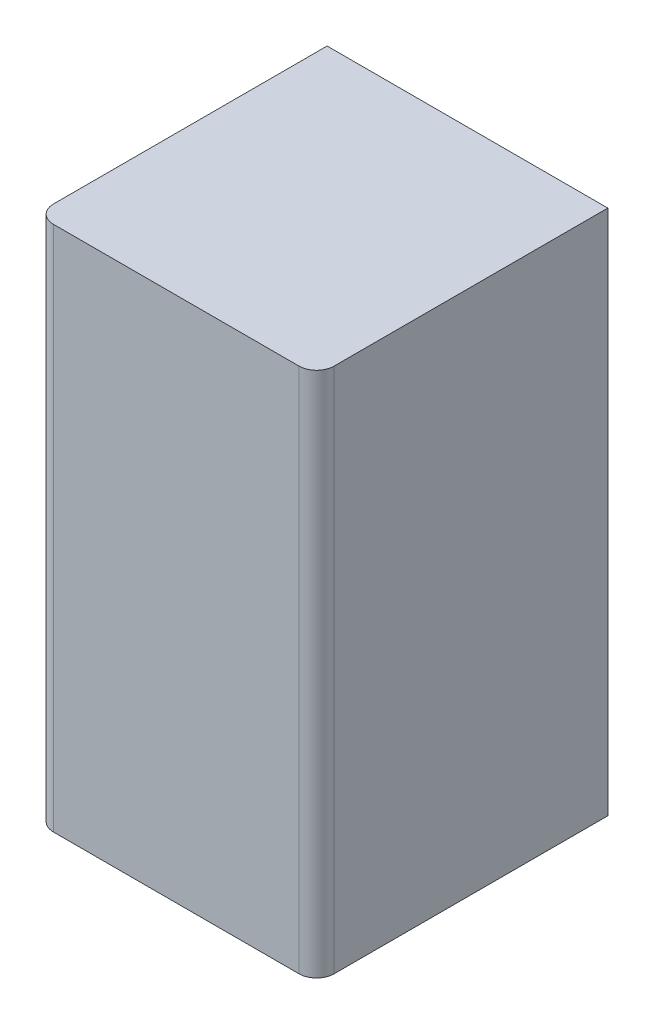
from build123d import *

# Parameters (mm, degrees)
SKETCH_1_W      = 16
SKETCH_1_H      = 30
EXTRUDE_1_DEPTH = 0.1
SKETCH_2_W      = 16
SKETCH_2_H      = 30
EXTRUDE_2_DEPTH = 16.5
FILLET_1_R      = 1


with BuildPart() as part:
    # 草图1 → 拉伸1 (new body)
    with BuildSketch(Plane.XY):
        Rectangle(SKETCH_1_W, SKETCH_1_H)
    extrude(amount=EXTRUDE_1_DEPTH)

    # 草图2 → 拉伸2 (add)
    with BuildSketch(Plane.XY.offset(0.1)):
        Rectangle(SKETCH_2_W, SKETCH_2_H)
    extrude(amount=EXTRUDE_2_DEPTH)

    # 圆角1
    fillet_1_edges = [part.edges().sort_by_distance(p)[0] for p in [
        (-8, 0, 16.6),
        (8, 0, 16.6),
    ]]
    fillet(fillet_1_edges, radius=FILLET_1_R)


solid = part.part
